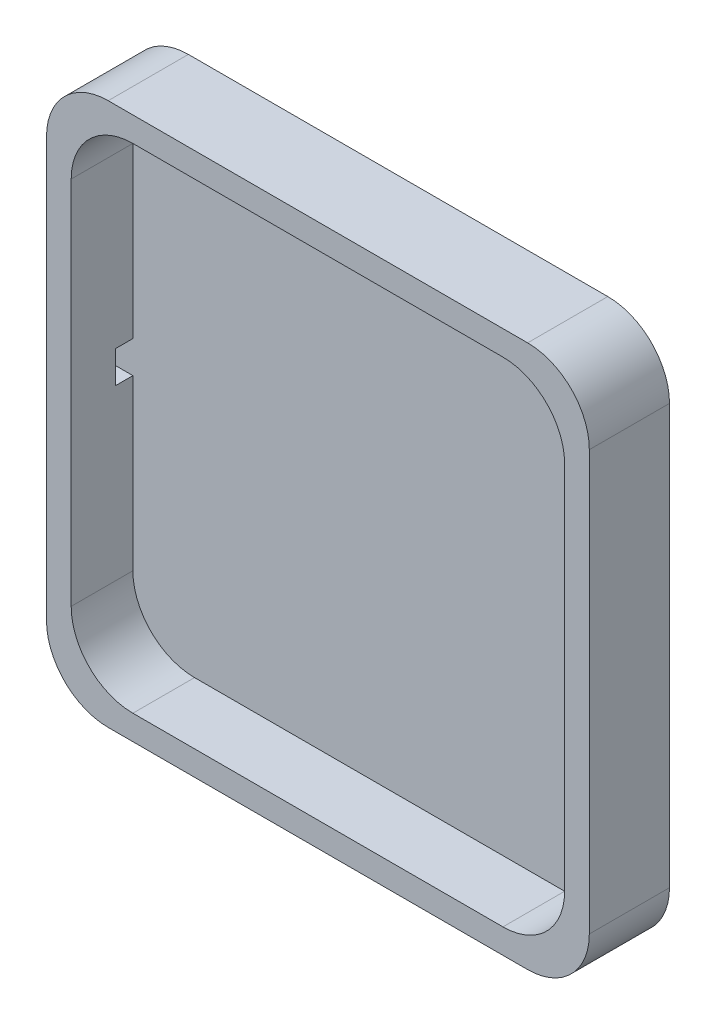
from build123d import *

# Parameters (mm, degrees)
EXTRUDE_1_DEPTH     = 1.5
EXTRUDE_2_DEPTH     = 5
SKETCH_5_W          = 1.4
SKETCH_5_H          = 2.6
CUT_EXTRUDE_1_DEPTH = 48.8565565


with BuildPart() as part:
    # 草图1 → 凸台-拉伸1 (new body)
    with BuildSketch(Plane.XY):
        with BuildLine():
            Line((-17, 22), (17, 22))
            ThreePointArc((17, 22), (20.535533906, 20.535533906), (22, 17))
            Line((22, 17), (22, -17))
            ThreePointArc((22, -17), (20.535533906, -20.535533906), (17, -22))
            Line((17, -22), (-17, -22))
            ThreePointArc((-17, -22), (-20.535533906, -20.535533906), (-22, -17))
            Line((-22, -17), (-22, 17))
            ThreePointArc((-22, 17), (-20.535533906, 20.535533906), (-17, 22))
        make_face()
    extrude(amount=EXTRUDE_1_DEPTH)

    # 草图2 → 凸台-拉伸2 (add)
    with BuildSketch(Plane.XY.offset(1.5)):
        with BuildLine():
            Line((-17, 22), (17, 22))
            ThreePointArc((17, 22), (20.535533906, 20.535533906), (22, 17))
            Line((22, 17), (22, -17))
            ThreePointArc((22, -17), (20.535533906, -20.535533906), (17, -22))
            Line((17, -22), (-17, -22))
            ThreePointArc((-17, -22), (-20.535533906, -20.535533906), (-22, -17))
            Line((-22, -17), (-22, 17))
            ThreePointArc((-22, 17), (-20.535533906, 20.535533906), (-17, 22))
        make_face()
        with BuildLine():
            Line((-15, 20), (15, 20))
            ThreePointArc((15, 20), (18.535533906, 18.535533906), (20, 15))
            Line((20, 15), (20, -15))
            ThreePointArc((20, -15), (18.535533906, -18.535533906), (15, -20))
            Line((15, -20), (-15, -20))
            ThreePointArc((-15, -20), (-18.535533906, -18.535533906), (-20, -15))
            Line((-20, -15), (-20, 15))
            ThreePointArc((-20, 15), (-18.535533906, 18.535533906), (-15, 20))
        make_face(mode=Mode.SUBTRACT)
    extrude(amount=EXTRUDE_2_DEPTH)

    # 草图5 → 切除-拉伸1 (cut, through all)
    with BuildSketch(Plane(origin=(-20, 0, 0), x_dir=(0, 0, -1), z_dir=(1, 0, 0))):
        with Locations((-2.2, 0)):
            Rectangle(SKETCH_5_W, SKETCH_5_H)
    extrude(amount=-CUT_EXTRUDE_1_DEPTH, mode=Mode.SUBTRACT)


solid = part.part
